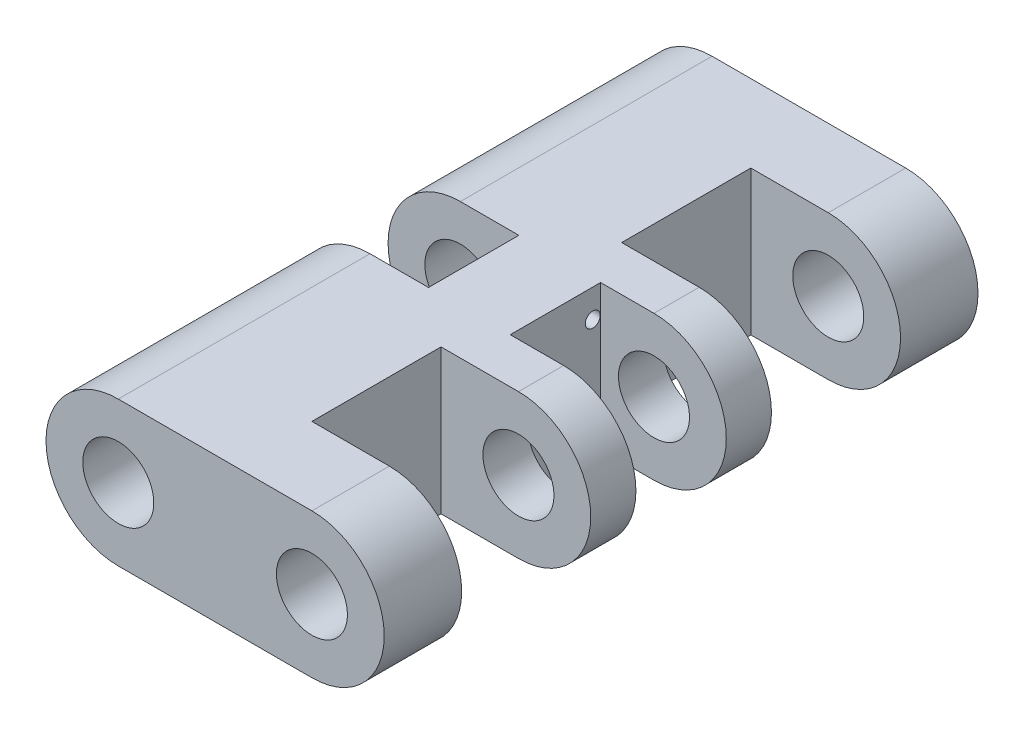
from build123d import *

# Parameters (mm, degrees)
SKETCH1_R           = 3.4925
BOSS_EXTRUDE1_DEPTH = 58.42
SKETCH2_W           = 21.884407041
SKETCH2_H           = 12.7
SKETCH2_W_2         = 26.524954362
SKETCH2_W_3         = 12.7
SKETCH2_H_2         = 8.89
CUT_EXTRUDE1_DEPTH  = 14.224
SKETCH4_W           = 15.997333927
SKETCH4_H           = 8.89
CUT_EXTRUDE2_DEPTH  = 14.224
SKETCH5_R           = 0.7366
SKETCH5_R_2         = 1.016
CUT_EXTRUDE3_DEPTH  = 12.7


with BuildPart() as part:
    # Sketch1 → Boss-Extrude1 (new body)
    with BuildSketch(Plane.XY):
        with BuildLine():
            Line((0, 7.112), (19.05, 7.112))
            ThreePointArc((19.05, 7.112), (26.162, 0), (19.05, -7.112))
            Line((19.05, -7.112), (0, -7.112))
            ThreePointArc((0, -7.112), (-7.112, 0), (0, 7.112))
        make_face()
        with Locations(Location((0, 0, 0), (0, 0, 180))):
            Circle(SKETCH1_R, mode=Mode.SUBTRACT)
        with Locations(Location((19.05, 0, 0), (0, 0, 180))):
            Circle(SKETCH1_R, mode=Mode.SUBTRACT)
    extrude(amount=BOSS_EXTRUDE1_DEPTH)

    # Sketch2 → Cut-Extrude1 (cut)
    with BuildSketch(Plane(origin=(0, 7.112, 0), x_dir=(1, 0, 0), z_dir=(0, 1, 0))):
        with Locations((22.372203521, -13.97)):
            Rectangle(SKETCH2_W, SKETCH2_H)
        with Locations((24.692477181, -44.45)):
            Rectangle(SKETCH2_W_2, SKETCH2_H)
        with Locations((20.147317334, -29.21)):
            Rectangle(SKETCH2_W_3, SKETCH2_H_2)
    extrude(amount=-CUT_EXTRUDE1_DEPTH, mode=Mode.SUBTRACT)

    # Sketch4 → Cut-Extrude2 (cut)
    with BuildSketch(Plane(origin=(0, 7.112, 0), x_dir=(1, 0, 0), z_dir=(0, 1, 0))):
        with Locations((-2.244730027, -29.21)):
            Rectangle(SKETCH4_W, SKETCH4_H)
    extrude(amount=-CUT_EXTRUDE2_DEPTH, mode=Mode.SUBTRACT)

    # Sketch5 → Cut-Extrude3 (cut)
    with BuildSketch(Plane.ZY.offset(-5.753936937)):
        with Locations((25.537266397, 4.339945309)):
            Circle(SKETCH5_R)
        with Locations(Location((32.903266397, 4.339945309, 0), (0, 0, 317.722495694))):
            Circle(SKETCH5_R_2)
    extrude(amount=-CUT_EXTRUDE3_DEPTH, mode=Mode.SUBTRACT)


solid = part.part
